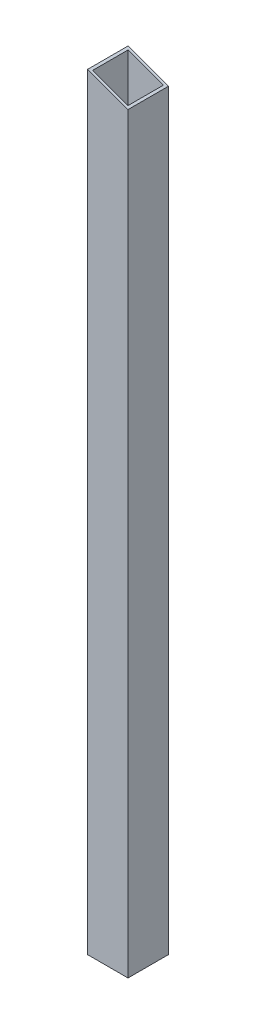
from build123d import *

# Parameters (mm, degrees)
SKETCH1_W           = 25.4
SKETCH1_H           = 25.4
SKETCH1_W_2         = 22.225
SKETCH1_H_2         = 22.225
BOSS_EXTRUDE1_DEPTH = 482.6
CUT_EXTRUDE1_DEPTH  = 25.4


with BuildPart() as part:
    # Sketch1 → Boss-Extrude1 (new body)
    with BuildSketch(Plane(origin=(0, 0, 0), x_dir=(1, 0, 0), z_dir=(0, 1, 0))):
        Rectangle(SKETCH1_W, SKETCH1_H)
        Rectangle(SKETCH1_W_2, SKETCH1_H_2, mode=Mode.SUBTRACT)
    extrude(amount=BOSS_EXTRUDE1_DEPTH)

    # Sketch2 → Cut-Extrude1 (cut)
    with BuildSketch(Plane.XY.offset(12.7)):
        Polygon((-12.7, 482.6), (12.7, 473.35515605), (12.7, 482.6), align=None)
    extrude(amount=-CUT_EXTRUDE1_DEPTH, mode=Mode.SUBTRACT)


solid = part.part
